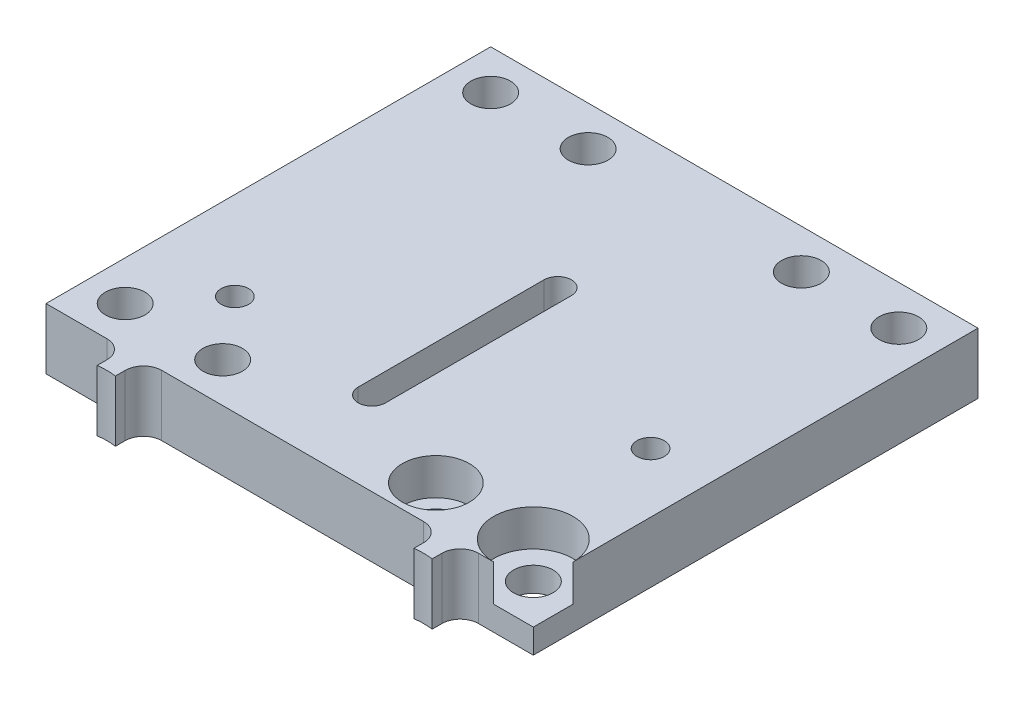
from build123d import *

# Parameters (mm, degrees)
SKETCH1_W           = 80
SKETCH1_H           = 73
BOSS_EXTRUDE1_DEPTH = 10
SKETCH3_R           = 3.25
CUT_EXTRUDE1_DEPTH  = 10
SKETCH4_W           = 80
SKETCH4_H           = 30
SKETCH4_R           = 11.5
BOSS_EXTRUDE2_DEPTH = 10
BOSS_EXTRUDE3_START = 6
SKETCH5_W           = 80
SKETCH5_H           = 29.5
SKETCH5_R           = 11.5
BOSS_EXTRUDE3_DEPTH = 6
SKETCH6_R           = 2.25
CUT_EXTRUDE2_DEPTH  = 28
SKETCH7_W           = 80
SKETCH7_H           = 30
CUT_EXTRUDE3_DEPTH  = 20
BOSS_EXTRUDE4_DEPTH = 10
SKETCH9_R           = 5.5
CUT_EXTRUDE4_DEPTH  = 6
FILLET1_R           = 3
SKETCH10_R          = 2.25
CUT_EXTRUDE5_DEPTH  = 16
CUT_EXTRUDE6_DEPTH  = 6


with BuildPart() as part:
    # Sketch1 → Boss-Extrude1 (new body)
    with BuildSketch(Plane(origin=(0, 0, 0), x_dir=(1, 0, 0), z_dir=(0, 1, 0))):
        with Locations((40, 36.5)):
            Rectangle(SKETCH1_W, SKETCH1_H)
    extrude(amount=BOSS_EXTRUDE1_DEPTH)

    # Sketch3 → Cut-Extrude1 (cut)
    with BuildSketch(Plane(origin=(0, 0, 0), x_dir=(-1, 0, 0), z_dir=(0, -1, 0))):
        with Locations(Location((-6.5, 6.5, 0), (0, 0, 90))):
            Circle(SKETCH3_R)
        with Locations(Location((-22.5, 6.5, 0), (0, 0, 90))):
            Circle(SKETCH3_R)
        with Locations(Location((-57.5, 6.5, 0), (0, 0, 90))):
            Circle(SKETCH3_R)
        with Locations(Location((-73.5, 6.5, 0), (0, 0, 90))):
            Circle(SKETCH3_R)
        with Locations(Location((-73.5, 66.5, 0), (0, 0, 270))):
            Circle(SKETCH3_R)
        with Locations(Location((-57.5, 66.5, 0), (0, 0, 270))):
            Circle(SKETCH3_R)
        with Locations(Location((-22.5, 66.5, 0), (0, 0, 270))):
            Circle(SKETCH3_R)
        with Locations(Location((-6.5, 66.5, 0), (0, 0, 270))):
            Circle(SKETCH3_R)
    extrude(amount=-CUT_EXTRUDE1_DEPTH, mode=Mode.SUBTRACT)

    # Sketch4 → Boss-Extrude2 (add)
    with BuildSketch(Plane(origin=(0, 10, 0), x_dir=(1, 0, 0), z_dir=(0, 1, 0))):
        with Locations((40, -15)):
            Rectangle(SKETCH4_W, SKETCH4_H)
        with Locations(Location((14, -14, 0), (0, 0, 270))):
            Circle(SKETCH4_R, mode=Mode.SUBTRACT)
        with Locations(Location((66, -14, 0), (0, 0, 270))):
            Circle(SKETCH4_R, mode=Mode.SUBTRACT)
    extrude(amount=-BOSS_EXTRUDE2_DEPTH)

    # Sketch5 → Boss-Extrude3 (add)
    with BuildSketch(Plane(origin=(0, 10, 0), x_dir=(1, 0, 0), z_dir=(0, 1, 0)).offset(BOSS_EXTRUDE3_START)):
        with Locations((40, -15.25)):
            Rectangle(SKETCH5_W, SKETCH5_H)
        with Locations(Location((14, -14, 0), (0, 0, 270))):
            Circle(SKETCH5_R, mode=Mode.SUBTRACT)
        with Locations(Location((66, -14, 0), (0, 0, 270))):
            Circle(SKETCH5_R, mode=Mode.SUBTRACT)
    extrude(amount=-BOSS_EXTRUDE3_DEPTH)

    # Sketch6 → Cut-Extrude2 (cut)
    with BuildSketch(Plane(origin=(0, 10, 0), x_dir=(1, 0, 0), z_dir=(0, 1, 0))):
        with Locations(Location((70.25, 29, 0), (0, 0, 270))):
            Circle(SKETCH6_R)
        with BuildLine():
            Line((37.5, 13.75), (37.5, 44.25))
            ThreePointArc((37.5, 44.25), (39.75, 46.5), (42, 44.25))
            Line((42, 44.25), (42, 13.75))
            ThreePointArc((42, 13.75), (39.75, 11.5), (37.5, 13.75))
        make_face()
    extrude(amount=-CUT_EXTRUDE2_DEPTH, mode=Mode.SUBTRACT)

    # Sketch7 → Cut-Extrude3 (cut)
    with BuildSketch(Plane(origin=(0, 16, 0), x_dir=(1, 0, 0), z_dir=(0, 1, 0))):
        with Locations((40, -15)):
            Rectangle(SKETCH7_W, SKETCH7_H)
    extrude(amount=-CUT_EXTRUDE3_DEPTH, mode=Mode.SUBTRACT)

    # Sketch8 → Boss-Extrude4 (add)
    with BuildSketch(Plane(origin=(0, 10, 0), x_dir=(1, 0, 0), z_dir=(0, 1, 0))):
        with BuildLine():
            Line((13, -4.602752641), (13, 0))
            Line((13, 0), (16, 0))
            Line((16, 0), (16, -4.602752641))
            ThreePointArc((16, -4.602752641), (14.5, -4.5), (13, -4.602752641))
        make_face()
        with BuildLine():
            Line((65, 0), (65, -4.602752641))
            ThreePointArc((65, -4.602752641), (66.5, -4.5), (68, -4.602752641))
            Line((68, -4.602752641), (68, 0))
            Line((68, 0), (65, 0))
        make_face()
    extrude(amount=-BOSS_EXTRUDE4_DEPTH)

    # Sketch9 → Cut-Extrude4 (cut)
    with BuildSketch(Plane(origin=(0, 10, 0), x_dir=(1, 0, 0), z_dir=(0, 1, 0))):
        with Locations(Location((57.5, 6.5, 0), (0, 0, 270))):
            Circle(SKETCH9_R)
        with BuildLine():
            Line((73.5, 0), (80, 0))
            Line((80, 0), (80, 6.5))
            ThreePointArc((80, 6.5), (68.903805922, 11.096194078), (73.5, 0))
        make_face()
    extrude(amount=-CUT_EXTRUDE4_DEPTH, mode=Mode.SUBTRACT)

    # Fillet1
    fillet1_edges = [part.edges().sort_by_distance(p)[0] for p in [
        (13, 5, 0),
        (16, 5, 0),
        (65, 5, 0),
        (68, 5, 0),
    ]]
    fillet(fillet1_edges, radius=FILLET1_R)

    # Sketch10 → Cut-Extrude5 (cut)
    with BuildSketch(Plane(origin=(0, 10, 0), x_dir=(1, 0, 0), z_dir=(0, 1, 0))):
        with Locations(Location((14.5, 16.5, 0), (0, 0, 270))):
            Circle(SKETCH10_R)
    extrude(amount=-CUT_EXTRUDE5_DEPTH, mode=Mode.SUBTRACT)

    # Sketch11 → Cut-Extrude6 (cut)
    with BuildSketch(Plane(origin=(0, 0, 0), x_dir=(-1, 0, 0), z_dir=(0, -1, 0))):
        Polygon((-10.458548116, 16.5), (-12.479274058, 20), (-16.520725942, 20), (-18.541451884, 16.5), (-16.520725942, 13), (-12.479274058, 13), align=None)
    extrude(amount=-CUT_EXTRUDE6_DEPTH, mode=Mode.SUBTRACT)


solid = part.part
